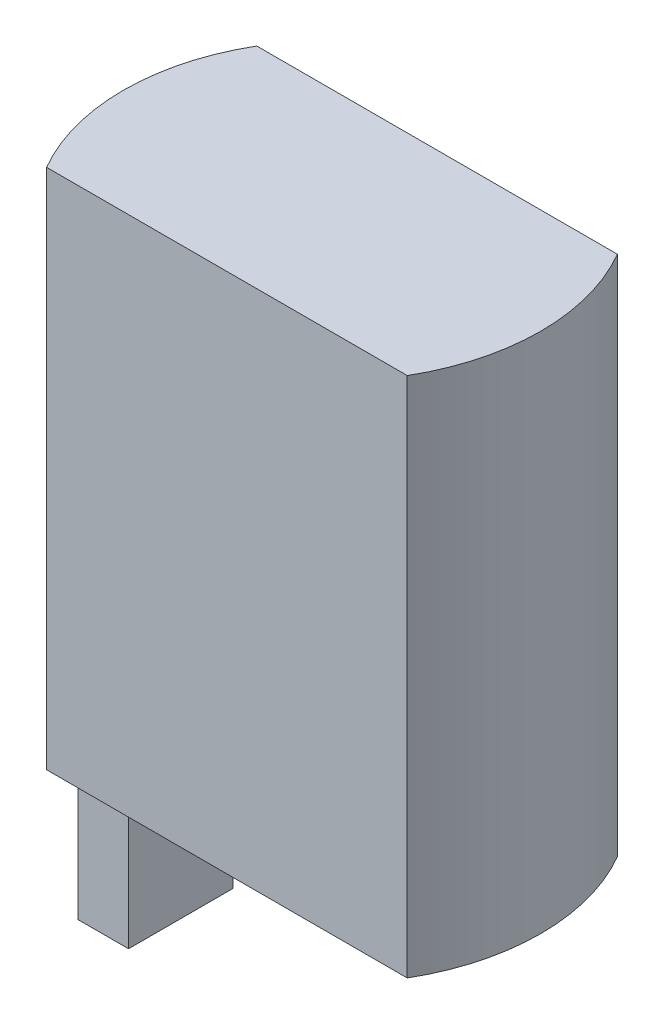
from build123d import *

# Parameters (mm, degrees)
SKETCH1_R           = 10
BOSS_EXTRUDE1_DEPTH = 25
SKETCH2_W           = 0.8
SKETCH2_H           = 5
BOSS_EXTRUDE2_DEPTH = 8
BOSS_EXTRUDE3_DEPTH = 1.2
CUT_EXTRUDE1_DEPTH  = 25
SKETCH6_W           = 5
SKETCH6_H           = 8
BOSS_EXTRUDE4_DEPTH = 0.8
CUT_EXTRUDE2_REACH  = 29.411


with BuildPart() as part:
    # Sketch1 → Boss-Extrude1 (new body)
    with BuildSketch(Plane(origin=(0, 0, 0), x_dir=(1, 0, 0), z_dir=(0, 1, 0))):
        with Locations(Location((0, 0, 0), (0, 0, 270))):
            Circle(SKETCH1_R)
    extrude(amount=BOSS_EXTRUDE1_DEPTH)

    # Sketch5 → Cut-Extrude1 (cut)
    with BuildSketch(Plane.XZ):
        with BuildLine():
            Line((-8.64, -5.034918073), (8.64, -5.034918073))
            ThreePointArc((8.64, -5.034918073), (0, -10), (-8.64, -5.034918073))
        make_face()
        with BuildLine():
            Line((-8.64, 5.034918073), (8.64, 5.034918073))
            ThreePointArc((8.64, 5.034918073), (0, 10), (-8.64, 5.034918073))
        make_face()
    extrude(amount=-CUT_EXTRUDE1_DEPTH, mode=Mode.SUBTRACT)



with BuildPart() as body_2:
    # Sketch2 → Boss-Extrude2 (new body)
    with BuildSketch(Plane(origin=(0, 0, 0), x_dir=(-1, 0, 0), z_dir=(0, -1, 0))):
        with Locations((7.65, 0)):
            Rectangle(SKETCH2_W, SKETCH2_H)
    extrude(amount=BOSS_EXTRUDE2_DEPTH)

    # Sketch3 → Boss-Extrude3 (add)
    with BuildSketch(Plane.ZY.offset(8.05)):
        Polygon((-2.5, -8), (-2.5, 0), (2.5, 0), (2.5, -8), (1.5, -8), (1.5, -0.75), (-1.5, -0.75), (-1.5, -8), align=None)
    extrude(amount=BOSS_EXTRUDE3_DEPTH)


with BuildPart() as part_1:
    add(part.part)

    add(body_2.part)  # Boss-Extrude4 merges body 2
    # Sketch6 → Boss-Extrude4 (add)
    with BuildSketch(Plane.ZY.offset(9.25)):
        with Locations((0, -4)):
            Rectangle(SKETCH6_W, SKETCH6_H)
    extrude(amount=BOSS_EXTRUDE4_DEPTH)

    # Sketch7 → Cut-Extrude2 (cut, up to next)
    with BuildSketch(Plane(origin=(0, 0, 0), x_dir=(1, 0, 0), z_dir=(0, 1, 0)), mode=Mode.PRIVATE) as cut_extrude2_sk1:
        with BuildLine():
            Line((-9.682458366, 2.5), (-10.05, 2.5))
            Line((-10.05, 2.5), (-10.05, -2.5))
            Line((-10.05, -2.5), (-9.682458366, -2.5))
            ThreePointArc((-9.682458366, -2.5), (-10, 0), (-9.682458366, 2.5))
        make_face()
    cut_extrude2_tool1 = extrude(cut_extrude2_sk1.sketch, amount=-CUT_EXTRUDE2_REACH, mode=Mode.PRIVATE) & part_1.part
    add(cut_extrude2_tool1.solids().sort_by_distance((-9.866229, 0, -2.449865))[0], mode=Mode.SUBTRACT)


solid = part_1.part
